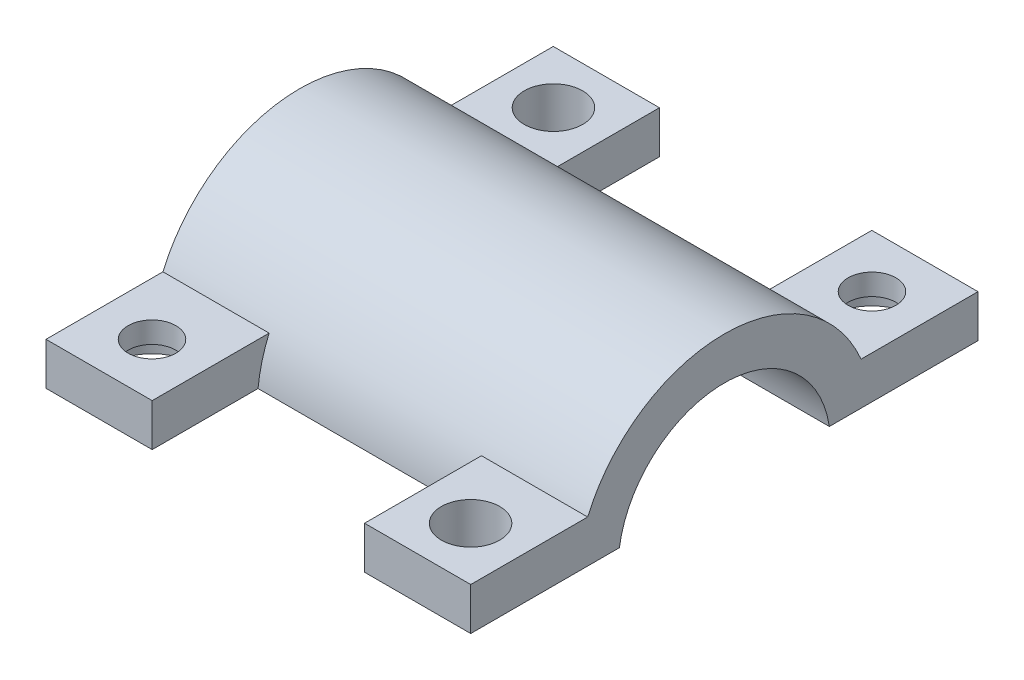
from build123d import *

# Parameters (mm, degrees)
BOSS_EXTRUDE2_DEPTH = 20
SKETCH2_W           = 10
SKETCH2_H           = 14
SKETCH2_R           = 2.75
SKETCH2_R_2         = 2.25
BOSS_EXTRUDE3_DEPTH = 4
SKETCH6_R           = 4
CUT_EXTRUDE1_DEPTH  = 2


with BuildPart() as part:
    # Sketch1 → Boss-Extrude2 (new, symmetric)
    with BuildSketch(Plane(origin=(0, 0, 0), x_dir=(0, 0, -1), z_dir=(1, 0, 0))):
        with BuildLine():
            Line((-13.919410907, 1.5), (-9.886859967, 1.5))
            ThreePointArc((-9.886859967, 1.5), (0, 10), (9.886859967, 1.5))
            Line((9.886859967, 1.5), (13.919410907, 1.5))
            ThreePointArc((13.919410907, 1.5), (0, 14), (-13.919410907, 1.5))
        make_face()
    extrude(amount=BOSS_EXTRUDE2_DEPTH, both=True)

    # Sketch2 → Boss-Extrude3 (add)
    # profile 1 of 4: a face of its own
    with BuildSketch(Plane.XZ.offset(-1.5)):
        with Locations((-15, -16.886859967)):
            Rectangle(SKETCH2_W, SKETCH2_H)
        with Locations(Location((-15, -18.903135437, 0), (0, 0, 270))):
            Circle(SKETCH2_R, mode=Mode.SUBTRACT)
    # profile 2 of 4: a face of its own
    with BuildSketch(Plane.XZ.offset(-1.5)):
        with Locations((15, -16.886859967)):
            Rectangle(SKETCH2_W, SKETCH2_H)
        with Locations(Location((15, -18.903135437, 0), (0, 0, 270))):
            Circle(SKETCH2_R_2, mode=Mode.SUBTRACT)
    # profile 3 of 4: a face of its own
    with BuildSketch(Plane.XZ.offset(-1.5)):
        with Locations((-15, 16.886859967)):
            Rectangle(SKETCH2_W, SKETCH2_H)
        with Locations(Location((-15, 18.903135437, 0), (0, 0, 270))):
            Circle(SKETCH2_R_2, mode=Mode.SUBTRACT)
    # profile 4 of 4: a face of its own
    with BuildSketch(Plane.XZ.offset(-1.5)):
        with Locations((15, 16.886859967)):
            Rectangle(SKETCH2_W, SKETCH2_H)
        with Locations(Location((15, 18.903135437, 0), (0, 0, 270))):
            Circle(SKETCH2_R, mode=Mode.SUBTRACT)
    extrude(amount=-BOSS_EXTRUDE3_DEPTH)

    # Sketch6 → Cut-Extrude1 (cut)
    with BuildSketch(Plane.XZ.offset(-1.5)):
        with Locations(Location((-15, 18.903135437, 0), (0, 0, 270))):
            Circle(SKETCH6_R)
        with Locations(Location((15, -18.903135437, 0), (0, 0, 270))):
            Circle(SKETCH6_R)
    extrude(amount=-CUT_EXTRUDE1_DEPTH, mode=Mode.SUBTRACT)


solid = part.part
